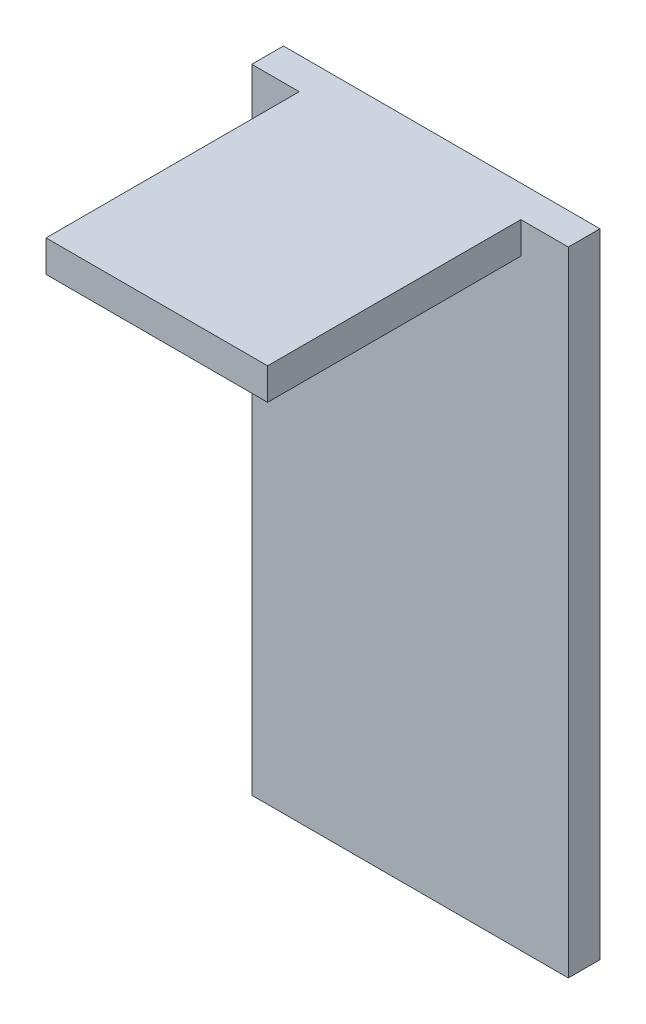
from build123d import *

# Parameters (mm, degrees)
SKETCH1_W           = 35
SKETCH1_H           = 40
BOSS_EXTRUDE1_DEPTH = 5
SKETCH5_W           = 50
SKETCH5_H           = 5
BOSS_EXTRUDE2_DEPTH = 100


with BuildPart() as part:
    # Sketch1 → Boss-Extrude1 (new body)
    with BuildSketch(Plane(origin=(0, 0, 0), x_dir=(1, 0, 0), z_dir=(0, 1, 0))):
        with Locations((17.5, 20)):
            Rectangle(SKETCH1_W, SKETCH1_H)
    extrude(amount=BOSS_EXTRUDE1_DEPTH)

    # Sketch5 → Boss-Extrude2 (add)
    with BuildSketch(Plane(origin=(0, 5, 0), x_dir=(1, 0, 0), z_dir=(0, 1, 0))):
        with Locations((17.5, 42.5)):
            Rectangle(SKETCH5_W, SKETCH5_H)
    extrude(amount=-BOSS_EXTRUDE2_DEPTH)


solid = part.part
